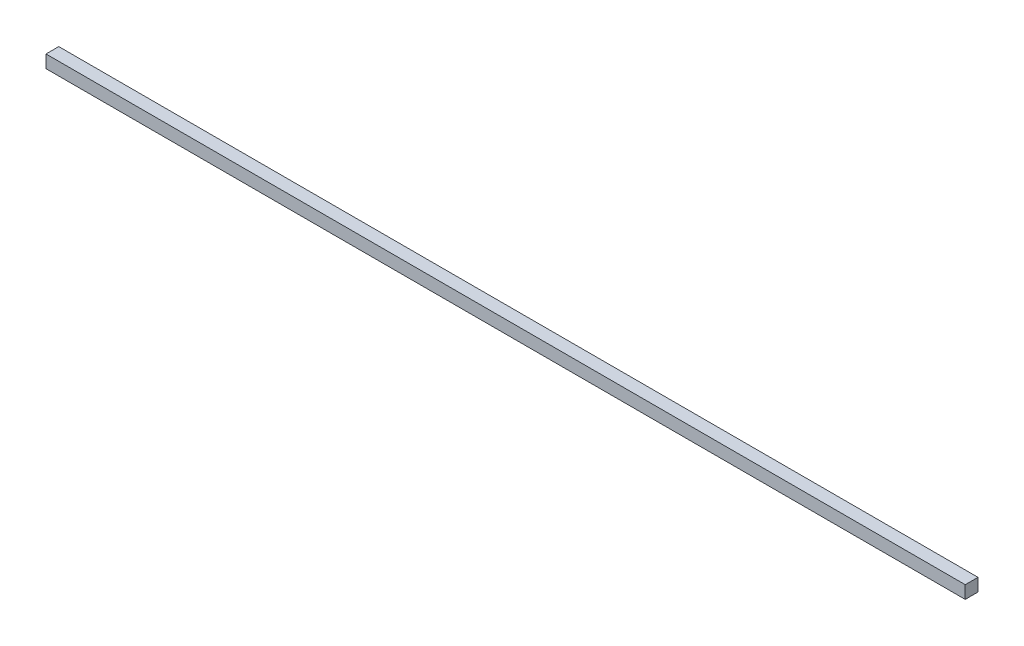
from build123d import *

# Parameters (mm, degrees)
SKETCH1_W           = 457.2
SKETCH1_H           = 6.35
BOSS_EXTRUDE1_DEPTH = 6.35


with BuildPart() as part:
    # Sketch1 → Boss-Extrude1 (new body)
    with BuildSketch(Plane.XY):
        with Locations((228.6, 3.175)):
            Rectangle(SKETCH1_W, SKETCH1_H)
    extrude(amount=BOSS_EXTRUDE1_DEPTH)


solid = part.part
